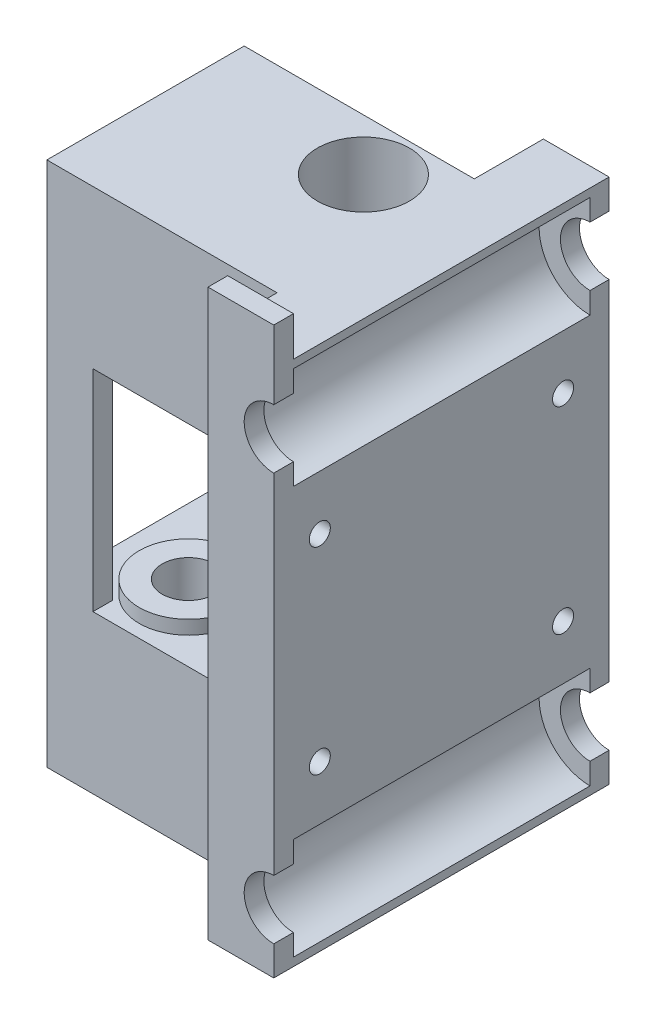
from build123d import *

# Parameters (mm, degrees)
SKETCH1_W            = 10
SKETCH1_H            = 80
BOSS_EXTRUDE1_DEPTH  = 51
SKETCH2_R            = 7.75
CUT_EXTRUDE1_DEPTH   = 45.1
SKETCH3_R            = 4.5
CUT_EXTRUDE2_DEPTH   = 96.399161422
SKETCH4_W            = 30
SKETCH4_H            = 80
SKETCH4_R            = 4.015
BOSS_EXTRUDE2_DEPTH  = 35
SKETCH4_3_R          = 4.015
BOSS_EXTRUDE3_DEPTH  = 30
CUT_EXTRUDE3_START   = -35
SKETCH5_W            = 24
SKETCH5_H            = 32
CUT_EXTRUDE3_DEPTH   = 35
SKETCH6_W            = 28
SKETCH6_H            = 32
CUT_EXTRUDE4_DEPTH   = 97.256168633
SKETCH12_W           = 10
SKETCH12_H           = 3
BOSS_EXTRUDE6_DEPTH  = 6
SKETCH14_R           = 1.6
CUT_EXTRUDE8_DEPTH   = 3
SKETCH14_2_R         = 1.6
CUT_EXTRUDE9_DEPTH   = 106.933941681
SKETCH15_R           = 4
CUT_EXTRUDE10_DEPTH  = 102.123686642
BOSS_EXTRUDE7_START  = 2.1
SKETCH16_R           = 7.5
SKETCH16_R_2         = 4
BOSS_EXTRUDE7_DEPTH  = 2.1
CUT_EXTRUDE11_START  = -14.5
SKETCH17_R           = 7.5
CUT_EXTRUDE11_DEPTH  = 14.5
SKETCH18_R           = 7.5
SKETCH18_R_2         = 4
BOSS_EXTRUDE8_DEPTH  = 5.45
SKETCH19_R           = 7
CUT_EXTRUDE12_DEPTH  = 17.8
SKETCH20_R           = 4
BOSS_EXTRUDE9_DEPTH  = 24
BOSS_EXTRUDE10_START = -24
SKETCH21_R           = 4
BOSS_EXTRUDE10_DEPTH = 24


with BuildPart() as part:
    # Sketch1 → Boss-Extrude1 (new body)
    with BuildSketch(Plane.XY):
        with Locations((5, 40)):
            Rectangle(SKETCH1_W, SKETCH1_H)
    extrude(amount=BOSS_EXTRUDE1_DEPTH)

    # Sketch2 → Cut-Extrude1 (cut)
    with BuildSketch(Plane.XY.offset(48)):
        with Locations((10, 9)):
            Circle(SKETCH2_R)
        with Locations((10, 71)):
            Circle(SKETCH2_R)
    extrude(amount=-CUT_EXTRUDE1_DEPTH, mode=Mode.SUBTRACT)

    # Sketch3 → Cut-Extrude2 (cut, through all)
    with BuildSketch(Plane.XY.offset(51)):
        with Locations((10, 71)):
            Circle(SKETCH3_R)
        with Locations((10, 9)):
            Circle(SKETCH3_R)
    extrude(amount=-CUT_EXTRUDE2_DEPTH, mode=Mode.SUBTRACT)

    # Sketch4 → Boss-Extrude2 (add)
    with BuildSketch(Plane.ZY):
        with Locations((25.5, 40)):
            Rectangle(SKETCH4_W, SKETCH4_H)
        with Locations((25.5, 71)):
            Circle(SKETCH4_R, mode=Mode.SUBTRACT)
        with Locations((25.5, 9)):
            Circle(SKETCH4_R, mode=Mode.SUBTRACT)
    extrude(amount=BOSS_EXTRUDE2_DEPTH)

    # Sketch4<3> → Boss-Extrude3 (add)
    with BuildSketch(Plane.ZY):
        with Locations((25.5, 71)):
            Circle(SKETCH4_3_R)
        with Locations((25.5, 9)):
            Circle(SKETCH4_3_R)
    extrude(amount=BOSS_EXTRUDE3_DEPTH)

    # Sketch5 → Cut-Extrude3 (cut)
    with BuildSketch(Plane.ZY.offset(35).offset(CUT_EXTRUDE3_START)):
        with Locations((25.5, 40)):
            Rectangle(SKETCH5_W, SKETCH5_H)
    extrude(amount=CUT_EXTRUDE3_DEPTH, mode=Mode.SUBTRACT)

    # Sketch6 → Cut-Extrude4 (cut, through all)
    with BuildSketch(Plane.XY.offset(40.5)):
        with Locations((-14, 40)):
            Rectangle(SKETCH6_W, SKETCH6_H)
    extrude(amount=-CUT_EXTRUDE4_DEPTH, mode=Mode.SUBTRACT)

    # Sketch12 → Boss-Extrude6 (add)
    with BuildSketch(Plane(origin=(0, 80, 0), x_dir=(1, 0, 0), z_dir=(0, 1, 0))):
        with Locations((5, -49.5)):
            Rectangle(SKETCH12_W, SKETCH12_H)
    extrude(amount=BOSS_EXTRUDE6_DEPTH)

    # Sketch14 → Cut-Extrude8 (cut)
    # profile 1 of 4: a face of its own
    with BuildSketch(Plane.ZY):
        Polygon((10.262029021, 55), (8.63101451, 57.825), (5.36898549, 57.825), (3.737970979, 55), (5.36898549, 52.175), (8.63101451, 52.175), align=None)
        with Locations((7, 55)):
            Circle(SKETCH14_R, mode=Mode.SUBTRACT)
    # profile 2 of 4: a face of its own
    with BuildSketch(Plane.ZY):
        Polygon((47.262029021, 55), (45.63101451, 57.825), (42.36898549, 57.825), (40.737970979, 55), (42.36898549, 52.175), (45.63101451, 52.175), align=None)
        with Locations((44, 55)):
            Circle(SKETCH14_R, mode=Mode.SUBTRACT)
    # profile 3 of 4: a face of its own
    with BuildSketch(Plane.ZY):
        Polygon((47.262029021, 25), (45.63101451, 27.825), (42.36898549, 27.825), (40.737970979, 25), (42.36898549, 22.175), (45.63101451, 22.175), align=None)
        with Locations((44, 25)):
            Circle(SKETCH14_R, mode=Mode.SUBTRACT)
    # profile 4 of 4: a face of its own
    with BuildSketch(Plane.ZY):
        Polygon((10.262029021, 25), (8.63101451, 27.825), (5.36898549, 27.825), (3.737970979, 25), (5.36898549, 22.175), (8.63101451, 22.175), align=None)
        with Locations((7, 25)):
            Circle(SKETCH14_R, mode=Mode.SUBTRACT)
    extrude(amount=-CUT_EXTRUDE8_DEPTH, mode=Mode.SUBTRACT)

    # Sketch14<2> → Cut-Extrude9 (cut, through all)
    with BuildSketch(Plane.ZY):
        with Locations((7, 55)):
            Circle(SKETCH14_2_R)
        with Locations((44, 55)):
            Circle(SKETCH14_2_R)
        with Locations((44, 25)):
            Circle(SKETCH14_2_R)
        with Locations((7, 25)):
            Circle(SKETCH14_2_R)
    extrude(amount=-CUT_EXTRUDE9_DEPTH, mode=Mode.SUBTRACT)

    # Sketch15 → Cut-Extrude10 (cut, through all)
    with BuildSketch(Plane(origin=(0, 80, 0), x_dir=(1, 0, 0), z_dir=(0, 1, 0))):
        with Locations(Location((-9, -18.3627, 0), (0, 0, 270))):
            Circle(SKETCH15_R)
        with Locations(Location((-22.925, -31.0373, 0), (0, 0, 270))):
            Circle(SKETCH15_R)
    extrude(amount=-CUT_EXTRUDE10_DEPTH, mode=Mode.SUBTRACT)

    # Sketch16 → Boss-Extrude7 (add)
    with BuildSketch(Plane(origin=(0, 24, 0), x_dir=(1, 0, 0), z_dir=(0, 1, 0)).offset(BOSS_EXTRUDE7_START)):
        with Locations(Location((-22.925, -31.0373, 0), (0, 0, 90))):
            Circle(SKETCH16_R)
        with Locations(Location((-22.925, -31.0373, 0), (0, 0, 270))):
            Circle(SKETCH16_R_2, mode=Mode.SUBTRACT)
    extrude(amount=-BOSS_EXTRUDE7_DEPTH)

    # Sketch17 → Cut-Extrude11 (cut)
    with BuildSketch(Plane.XZ.offset(CUT_EXTRUDE11_START)):
        with Locations(Location((-22.925, 31.0373, 0), (0, 0, 270))):
            Circle(SKETCH17_R)
    extrude(amount=CUT_EXTRUDE11_DEPTH, mode=Mode.SUBTRACT)

    # Sketch18 → Boss-Extrude8 (add)
    with BuildSketch(Plane.XZ.offset(-56)):
        with Locations(Location((-9, 18.3627, 0), (0, 0, 90))):
            Circle(SKETCH18_R)
        with Locations(Location((-9, 18.3627, 0), (0, 0, 90))):
            Circle(SKETCH18_R_2, mode=Mode.SUBTRACT)
    extrude(amount=BOSS_EXTRUDE8_DEPTH)

    # Sketch19 → Cut-Extrude12 (cut)
    with BuildSketch(Plane(origin=(0, 80, 0), x_dir=(1, 0, 0), z_dir=(0, 1, 0))):
        with Locations(Location((-9, -18.3627, 0), (0, 0, 270))):
            Circle(SKETCH19_R)
    extrude(amount=-CUT_EXTRUDE12_DEPTH, mode=Mode.SUBTRACT)

    # Sketch20 → Boss-Extrude9 (add)
    with BuildSketch(Plane(origin=(0, 24, 0), x_dir=(1, 0, 0), z_dir=(0, 1, 0))):
        with Locations(Location((-9, -18.3627, 0), (0, 0, 270))):
            Circle(SKETCH20_R)
    extrude(amount=-BOSS_EXTRUDE9_DEPTH)

    # Sketch21 → Boss-Extrude10 (add)
    with BuildSketch(Plane.XZ.offset(-56).offset(BOSS_EXTRUDE10_START)):
        with Locations(Location((-22.925, 31.0373, 0), (0, 0, 90))):
            Circle(SKETCH21_R)
    extrude(amount=BOSS_EXTRUDE10_DEPTH)


solid = part.part
